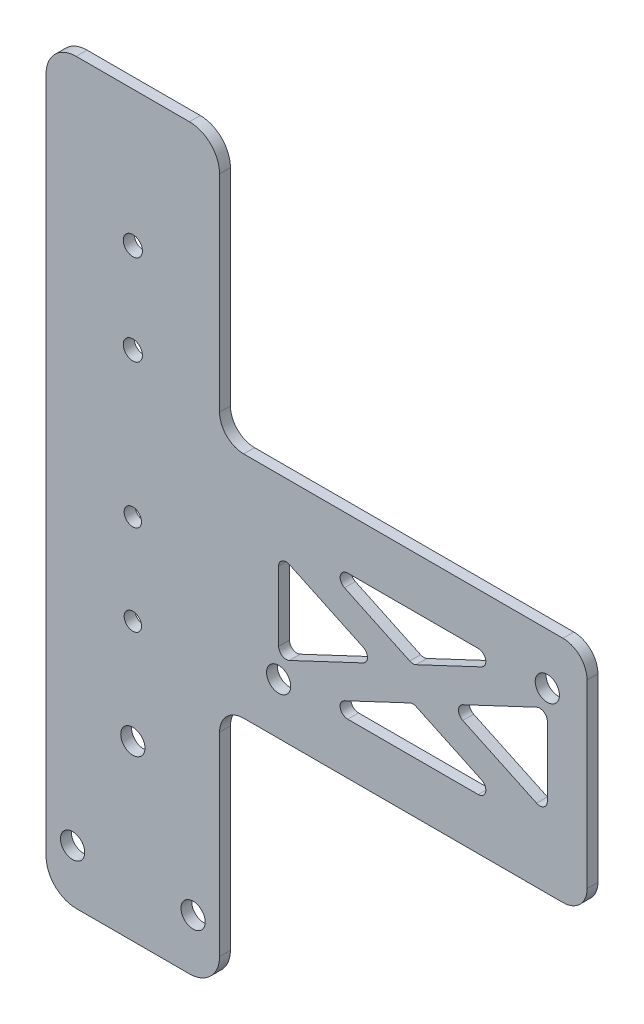
from build123d import *

# Parameters (mm, degrees)
SKETCH1_R           = 2.5527
SKETCH1_R_2         = 1.8288
SKETCH1_R_3         = 2.0193
BOSS_EXTRUDE1_DEPTH = 2.286
CUT_EXTRUDE1_DEPTH  = 128.490937977
FILLET1_R           = 1.5875


with BuildPart() as part:
    # Sketch1 → Boss-Extrude1 (new body)
    with BuildSketch(Plane.XY.offset(1.5875)):
        with BuildLine():
            Line((18.288, -65.0875), (18.288, -24.13))
            ThreePointArc((18.288, -24.13), (19.775897552, -20.537897552), (23.368, -19.05))
            Line((23.368, -19.05), (90.678, -19.05))
            ThreePointArc((90.678, -19.05), (94.270102448, -17.562102448), (95.758, -13.97))
            Line((95.758, -13.97), (95.758, 24.13))
            ThreePointArc((95.758, 24.13), (94.270102448, 27.722102448), (90.678, 29.21))
            Line((90.678, 29.21), (23.368, 29.21))
            ThreePointArc((23.368, 29.21), (19.775897552, 30.697897552), (18.288, 34.29))
            Line((18.288, 34.29), (18.288, 77.7875))
            ThreePointArc((18.288, 77.7875), (16.428128061, 82.277628061), (11.938, 84.1375))
            Line((11.938, 84.1375), (-11.938, 84.1375))
            ThreePointArc((-11.938, 84.1375), (-16.428128061, 82.277628061), (-18.288, 77.7875))
            Line((-18.288, 77.7875), (-18.288, -65.0875))
            ThreePointArc((-18.288, -65.0875), (-16.428128061, -69.577628061), (-11.938, -71.4375))
            Line((-11.938, -71.4375), (11.938, -71.4375))
            ThreePointArc((11.938, -71.4375), (16.428128061, -69.577628061), (18.288, -65.0875))
        make_face()
        with Locations(Location((87.376, 18.415, 0), (0, 0, 180))):
            Circle(SKETCH1_R, mode=Mode.SUBTRACT)
        with Locations(Location((30.734, -8.255, 0), (0, 0, 180))):
            Circle(SKETCH1_R, mode=Mode.SUBTRACT)
        with Locations(Location((0, -13.0175, 0), (0, 0, 180))):
            Circle(SKETCH1_R_2, mode=Mode.SUBTRACT)
        with Locations(Location((0, 6.0325, 0), (0, 0, 180))):
            Circle(SKETCH1_R_2, mode=Mode.SUBTRACT)
        with Locations(Location((0, 36.5125, 0), (0, 0, 180))):
            Circle(SKETCH1_R_3, mode=Mode.SUBTRACT)
        with Locations(Location((0, 55.5625, 0), (0, 0, 180))):
            Circle(SKETCH1_R_3, mode=Mode.SUBTRACT)
        with Locations(Location((12.7, -60.325, 0), (0, 0, 180))):
            Circle(SKETCH1_R, mode=Mode.SUBTRACT)
        with Locations(Location((-12.7, -60.325, 0), (0, 0, 180))):
            Circle(SKETCH1_R, mode=Mode.SUBTRACT)
        with Locations(Location((0, -34.925, 0), (0, 0, 180))):
            Circle(SKETCH1_R, mode=Mode.SUBTRACT)
    extrude(amount=-BOSS_EXTRUDE1_DEPTH)

    # Sketch2 → Cut-Extrude1 (cut, through all)
    with BuildSketch(Plane.XY.offset(1.5875)):
        Polygon((79.922815554, 18.415), (38.187184446, 18.415), (59.055, 8.589346937), align=None)
        Polygon((51.601815554, 5.08), (30.734, 14.905653063), (30.734, -4.745653063), align=None)
        Polygon((79.922815554, -8.255), (59.055, 1.570653063), (38.187184446, -8.255), align=None)
        Polygon((87.376, 14.905653063), (66.508184446, 5.08), (87.376, -4.745653063), align=None)
    extrude(amount=-CUT_EXTRUDE1_DEPTH, mode=Mode.SUBTRACT)

    # Fillet1
    fillet1_edges = [part.edges().sort_by_distance(p)[0] for p in [
        (30.734, 14.905653063, 0.4445),
        (51.601815554, 5.08, 0.4445),
        (59.055, 1.570653063, 0.4445),
        (79.922815554, -8.255, 0.4445),
        (38.187184446, -8.255, 0.4445),
        (66.508184446, 5.08, 0.4445),
        (87.376, 14.905653063, 0.4445),
        (87.376, -4.745653063, 0.4445),
        (38.187184446, 18.415, 0.4445),
        (79.922815554, 18.415, 0.4445),
        (59.055, 8.589346937, 0.4445),
        (30.734, -4.745653063, 0.4445),
    ]]
    fillet(fillet1_edges, radius=FILLET1_R)


solid = part.part
